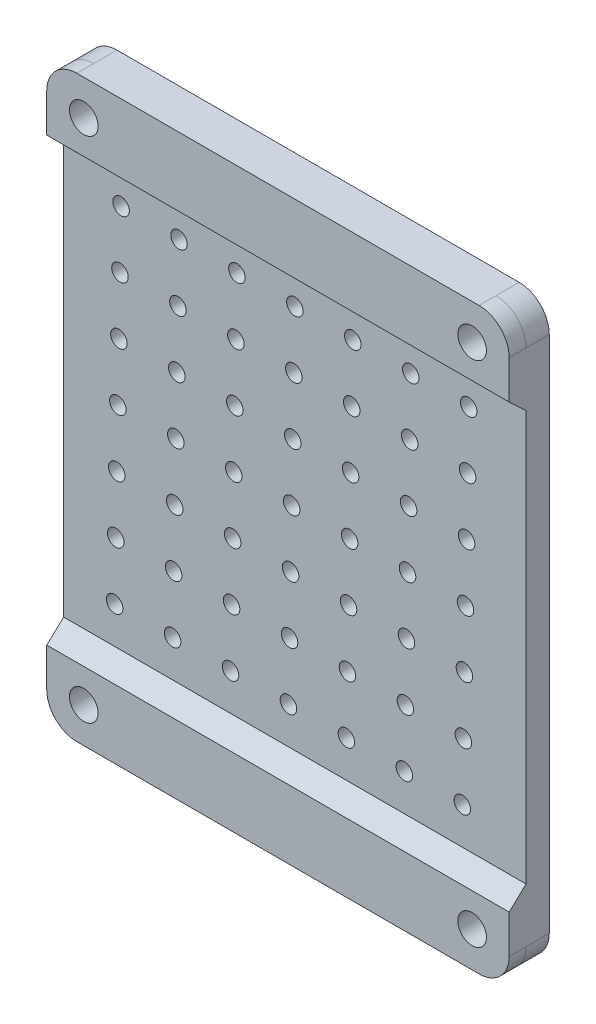
from build123d import *

# Parameters (mm, degrees)
SKETCH2_R           = 2.47
SKETCH2_R_2         = 1.425
BOSS_EXTRUDE1_DEPTH = 4
BOSS_EXTRUDE3_DEPTH = 39.9
FILLET6_R           = 5.2
SKETCH7_R           = 2.47
CUT_EXTRUDE2_DEPTH  = 39.9


with BuildPart() as part:
    # Sketch2 → Boss-Extrude1 (new body)
    with BuildSketch(Plane.XY):
        with BuildLine():
            Line((-34.7, -49.95), (34.7, -49.95))
            ThreePointArc((34.7, -49.95), (38.376955262, -48.426955262), (39.9, -44.75))
            Line((39.9, -44.75), (39.9, 44.75))
            ThreePointArc((39.9, 44.75), (38.376955262, 48.426955262), (34.7, 49.95))
            Line((34.7, 49.95), (-34.7, 49.95))
            ThreePointArc((-34.7, 49.95), (-38.376955262, 48.426955262), (-39.9, 44.75))
            Line((-39.9, 44.75), (-39.9, -44.75))
            ThreePointArc((-39.9, -44.75), (-38.376955262, -48.426955262), (-34.7, -49.95))
        make_face()
        with Locations((-33.51, -43.851299187)):
            Circle(SKETCH2_R, mode=Mode.SUBTRACT)
        with Locations(Location((33.51, -43.851299187, 0), (0, 0, 180))):
            Circle(SKETCH2_R, mode=Mode.SUBTRACT)
        with Locations((33.51, 43.851299187)):
            Circle(SKETCH2_R, mode=Mode.SUBTRACT)
        with Locations(Location((-33.51, 43.851299187, 0), (0, 0, 180))):
            Circle(SKETCH2_R, mode=Mode.SUBTRACT)
        with Locations((28.89, -29.02)):
            Circle(SKETCH2_R_2, mode=Mode.SUBTRACT)
        with Locations((18.891666667, -29.02)):
            Circle(SKETCH2_R_2, mode=Mode.SUBTRACT)
        with Locations((8.893333333, -29.02)):
            Circle(SKETCH2_R_2, mode=Mode.SUBTRACT)
        with Locations((-1.105, -29.02)):
            Circle(SKETCH2_R_2, mode=Mode.SUBTRACT)
        with Locations((-11.103333333, -29.02)):
            Circle(SKETCH2_R_2, mode=Mode.SUBTRACT)
        with Locations((-21.101666667, -29.02)):
            Circle(SKETCH2_R_2, mode=Mode.SUBTRACT)
        with Locations((-31.1, -29.02)):
            Circle(SKETCH2_R_2, mode=Mode.SUBTRACT)
        with Locations((19.075833333, -19.019976749)):
            Circle(SKETCH2_R_2, mode=Mode.SUBTRACT)
        with Locations((9.0775, -19.019976749)):
            Circle(SKETCH2_R_2, mode=Mode.SUBTRACT)
        with Locations((-0.920833333, -19.019976749)):
            Circle(SKETCH2_R_2, mode=Mode.SUBTRACT)
        with Locations((-10.919166667, -19.019976749)):
            Circle(SKETCH2_R_2, mode=Mode.SUBTRACT)
        with Locations((-20.9175, -19.019976749)):
            Circle(SKETCH2_R_2, mode=Mode.SUBTRACT)
        with Locations((-30.915833333, -19.019976749)):
            Circle(SKETCH2_R_2, mode=Mode.SUBTRACT)
        with Locations((19.26, -9.019953499)):
            Circle(SKETCH2_R_2, mode=Mode.SUBTRACT)
        with Locations((9.261666667, -9.019953499)):
            Circle(SKETCH2_R_2, mode=Mode.SUBTRACT)
        with Locations((-0.736666667, -9.019953499)):
            Circle(SKETCH2_R_2, mode=Mode.SUBTRACT)
        with Locations((-10.735, -9.019953499)):
            Circle(SKETCH2_R_2, mode=Mode.SUBTRACT)
        with Locations((-20.733333333, -9.019953499)):
            Circle(SKETCH2_R_2, mode=Mode.SUBTRACT)
        with Locations((-30.731666667, -9.019953499)):
            Circle(SKETCH2_R_2, mode=Mode.SUBTRACT)
        with Locations((19.444166667, 0.980069752)):
            Circle(SKETCH2_R_2, mode=Mode.SUBTRACT)
        with Locations((9.445833333, 0.980069752)):
            Circle(SKETCH2_R_2, mode=Mode.SUBTRACT)
        with Locations((-0.5525, 0.980069752)):
            Circle(SKETCH2_R_2, mode=Mode.SUBTRACT)
        with Locations((-10.550833333, 0.980069752)):
            Circle(SKETCH2_R_2, mode=Mode.SUBTRACT)
        with Locations((-20.549166667, 0.980069752)):
            Circle(SKETCH2_R_2, mode=Mode.SUBTRACT)
        with Locations((-30.5475, 0.980069752)):
            Circle(SKETCH2_R_2, mode=Mode.SUBTRACT)
        with Locations((19.628333333, 10.980093003)):
            Circle(SKETCH2_R_2, mode=Mode.SUBTRACT)
        with Locations((9.63, 10.980093003)):
            Circle(SKETCH2_R_2, mode=Mode.SUBTRACT)
        with Locations((-0.368333333, 10.980093003)):
            Circle(SKETCH2_R_2, mode=Mode.SUBTRACT)
        with Locations((-10.366666667, 10.980093003)):
            Circle(SKETCH2_R_2, mode=Mode.SUBTRACT)
        with Locations((-20.365, 10.980093003)):
            Circle(SKETCH2_R_2, mode=Mode.SUBTRACT)
        with Locations((-30.363333333, 10.980093003)):
            Circle(SKETCH2_R_2, mode=Mode.SUBTRACT)
        with Locations((19.8125, 20.980116253)):
            Circle(SKETCH2_R_2, mode=Mode.SUBTRACT)
        with Locations((9.814166667, 20.980116253)):
            Circle(SKETCH2_R_2, mode=Mode.SUBTRACT)
        with Locations((-0.184166667, 20.980116253)):
            Circle(SKETCH2_R_2, mode=Mode.SUBTRACT)
        with Locations((-10.1825, 20.980116253)):
            Circle(SKETCH2_R_2, mode=Mode.SUBTRACT)
        with Locations((-20.180833333, 20.980116253)):
            Circle(SKETCH2_R_2, mode=Mode.SUBTRACT)
        with Locations((-30.179166667, 20.980116253)):
            Circle(SKETCH2_R_2, mode=Mode.SUBTRACT)
        with Locations((19.996666667, 30.980139504)):
            Circle(SKETCH2_R_2, mode=Mode.SUBTRACT)
        with Locations((9.998333333, 30.980139504)):
            Circle(SKETCH2_R_2, mode=Mode.SUBTRACT)
        with Locations((0, 30.980139504)):
            Circle(SKETCH2_R_2, mode=Mode.SUBTRACT)
        with Locations((-9.998333333, 30.980139504)):
            Circle(SKETCH2_R_2, mode=Mode.SUBTRACT)
        with Locations((-19.996666667, 30.980139504)):
            Circle(SKETCH2_R_2, mode=Mode.SUBTRACT)
        with Locations((-29.995, 30.980139504)):
            Circle(SKETCH2_R_2, mode=Mode.SUBTRACT)
        with Locations((29.074166667, -19.019976749)):
            Circle(SKETCH2_R_2, mode=Mode.SUBTRACT)
        with Locations((29.258333333, -9.019953499)):
            Circle(SKETCH2_R_2, mode=Mode.SUBTRACT)
        with Locations((29.4425, 0.980069752)):
            Circle(SKETCH2_R_2, mode=Mode.SUBTRACT)
        with Locations((29.626666667, 10.980093003)):
            Circle(SKETCH2_R_2, mode=Mode.SUBTRACT)
        with Locations((29.810833333, 20.980116253)):
            Circle(SKETCH2_R_2, mode=Mode.SUBTRACT)
        with Locations((29.995, 30.980139504)):
            Circle(SKETCH2_R_2, mode=Mode.SUBTRACT)
    extrude(amount=BOSS_EXTRUDE1_DEPTH)

    # Sketch3 → Boss-Extrude3 (add, symmetric)
    with BuildSketch(Plane(origin=(0, 0, 0), x_dir=(0, 0, -1), z_dir=(1, 0, 0))):
        Polygon((-4, 49.95), (-6.92, 49.95), (-6.92, 38.11), (-4, 35.37621142), align=None)
        Polygon((-4, -49.95), (-4, -35.38), (-6.92, -38.11), (-6.92, -49.95), align=None)
    extrude(amount=BOSS_EXTRUDE3_DEPTH, both=True)

    # Fillet6
    fillet6_edges = [part.edges().sort_by_distance(p)[0] for p in [
        (39.9, 49.95, 5.46),
        (-39.9, 49.95, 5.46),
        (-39.9, -49.95, 5.46),
        (39.9, -49.95, 5.46),
    ]]
    fillet(fillet6_edges, radius=FILLET6_R)

    # Sketch7 → Cut-Extrude2 (cut, symmetric)
    with BuildSketch(Plane(origin=(0, 0, 4), x_dir=(-1, 0, 0), z_dir=(0, 0, -1))):
        with Locations(Location((-33.51, 43.851299187, 0), (0, 0, 90))):
            Circle(SKETCH7_R)
        with Locations((33.51, 43.851299187)):
            Circle(SKETCH7_R)
        with Locations((33.51, -43.851299187)):
            Circle(SKETCH7_R)
        with Locations((-33.51, -43.851299187)):
            Circle(SKETCH7_R)
    extrude(amount=CUT_EXTRUDE2_DEPTH, both=True, mode=Mode.SUBTRACT)


solid = part.part
